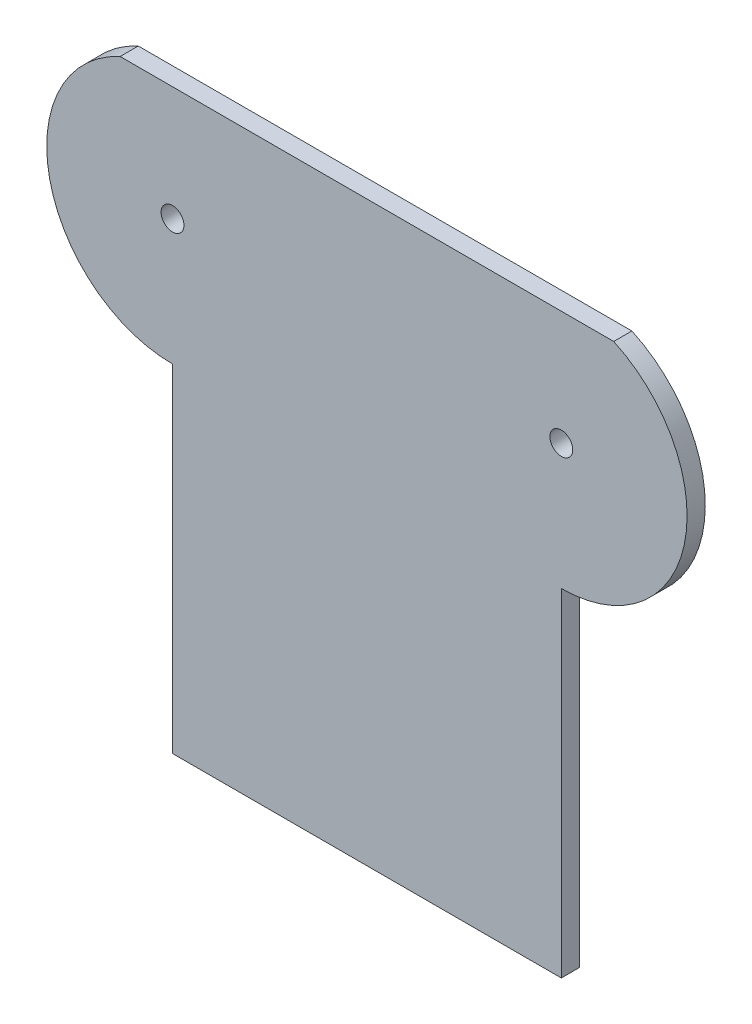
from build123d import *

# Parameters (mm, degrees)
SKETCH1_R           = 2
BOSS_EXTRUDE1_DEPTH = 3.175


with BuildPart() as part:
    # Sketch1 → Boss-Extrude1 (new body)
    with BuildSketch(Plane.XY):
        with BuildLine():
            Line((46.83484861, 70), (133.16515139, 70))
            ThreePointArc((133.16515139, 70), (145.49418526, 45.30958424), (124, 28))
            Line((124, 28), (124, 0))
            Line((124, 0), (124, -31))
            Line((124, -31), (56, -31))
            Line((56, -31), (56, 0))
            Line((56, 0), (56, 28))
            ThreePointArc((56, 28), (34.50581474, 45.30958424), (46.83484861, 70))
        make_face()
        with Locations((56, 50)):
            Circle(SKETCH1_R, mode=Mode.SUBTRACT)
        with Locations((124, 50)):
            Circle(SKETCH1_R, mode=Mode.SUBTRACT)
    extrude(amount=BOSS_EXTRUDE1_DEPTH)


solid = part.part
